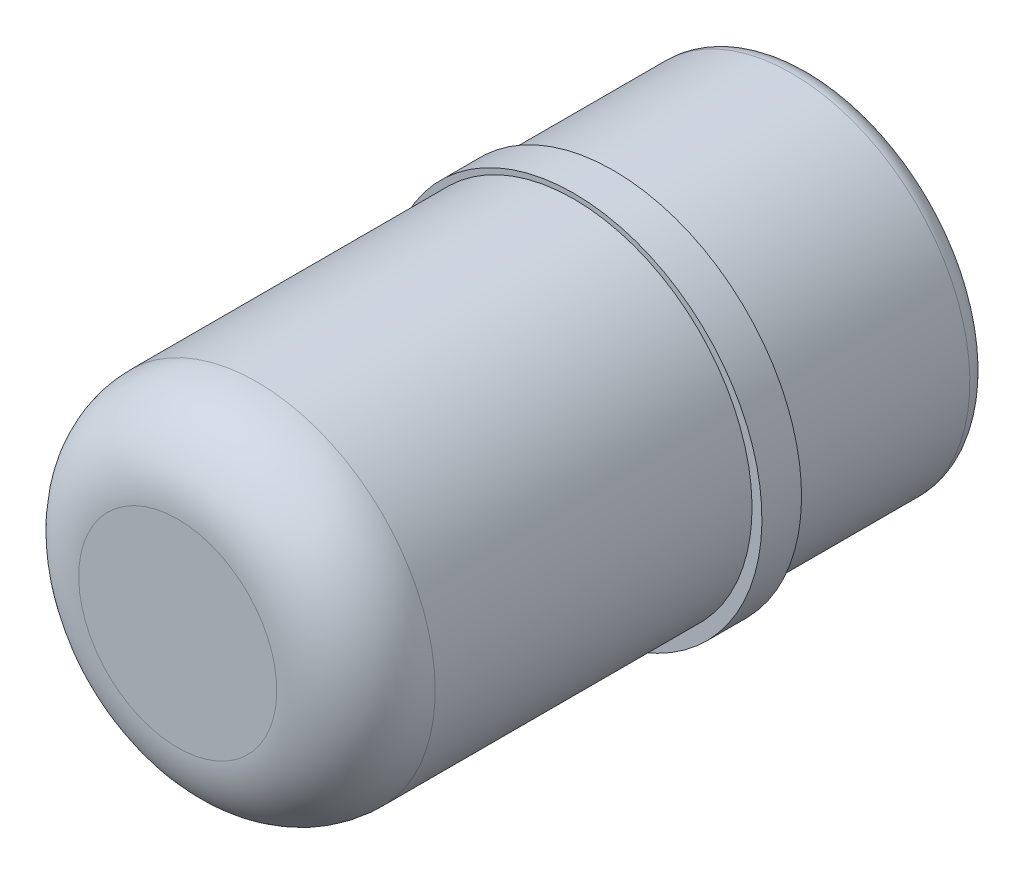
from build123d import *

# Parameters (mm, degrees)
SKETCH1_W   = 45
SKETCH1_H   = 100
SKETCH1_7_W = 45
SKETCH1_7_H = 50
FILLET1_R   = 20
FILLET2_R   = 5


with BuildPart() as part:
    # Sketch1 → Revolve2 (revolve)
    with BuildSketch(Plane.YZ):
        with Locations((0, 55)):
            Rectangle(SKETCH1_W, SKETCH1_H)
    revolve(axis=Axis((0, -22.5, 5), (0, 0, 1)))

    # Sketch1<6> → Revolve3 (revolve)
    with BuildSketch(Plane.YZ):
        Polygon((-23.75, 5), (-23.75, -5), (-22.5, -5), (22.5, -5), (23.75, -5), (23.75, 5), (22.5, 5), (-22.5, 5), align=None)
    revolve(axis=Axis((0, -23.75, -5), (0, 0, 1)))

    # Sketch1<7> → Revolve4 (revolve)
    with BuildSketch(Plane.YZ):
        with Locations((0, -30)):
            Rectangle(SKETCH1_7_W, SKETCH1_7_H)
    revolve(axis=Axis((0, -22.5, -55), (0, 0, 1)))

    # Fillet1
    fillet1_edges = [part.edges().sort_by_distance(p)[0] for p in [
        (0, -67.5, 105),
    ]]
    fillet(fillet1_edges, radius=FILLET1_R)

    # Fillet2
    fillet2_edges = [part.edges().sort_by_distance(p)[0] for p in [
        (0, -67.5, -55),
    ]]
    fillet(fillet2_edges, radius=FILLET2_R)


solid = part.part
